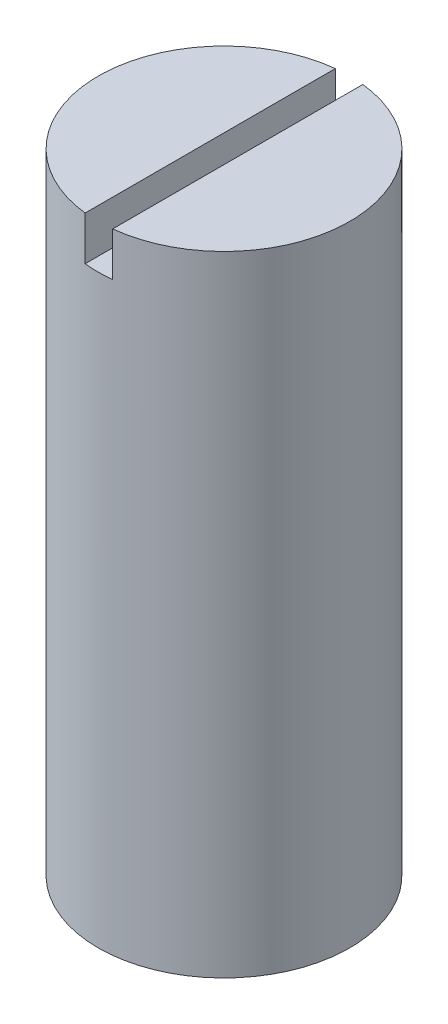
from build123d import *

# Parameters (mm, degrees)
SKETCH1_R           = 16
BOSS_EXTRUDE1_DEPTH = 80
SKETCH2_W           = 3.5
SKETCH2_H           = 7.5875
CUT_EXTRUDE1_DEPTH  = 18


with BuildPart() as part:
    # Sketch1 → Boss-Extrude1 (new body)
    with BuildSketch(Plane(origin=(0, 0, 0), x_dir=(1, 0, 0), z_dir=(0, 1, 0))):
        with Locations(Location((0, 0, 0), (0, 0, 270))):
            Circle(SKETCH1_R)
    extrude(amount=BOSS_EXTRUDE1_DEPTH)

    # Sketch2 → Cut-Extrude1 (cut, symmetric)
    with BuildSketch(Plane.XY):
        with Locations((0, 78.20625)):
            Rectangle(SKETCH2_W, SKETCH2_H)
    extrude(amount=CUT_EXTRUDE1_DEPTH, both=True, mode=Mode.SUBTRACT)


solid = part.part
